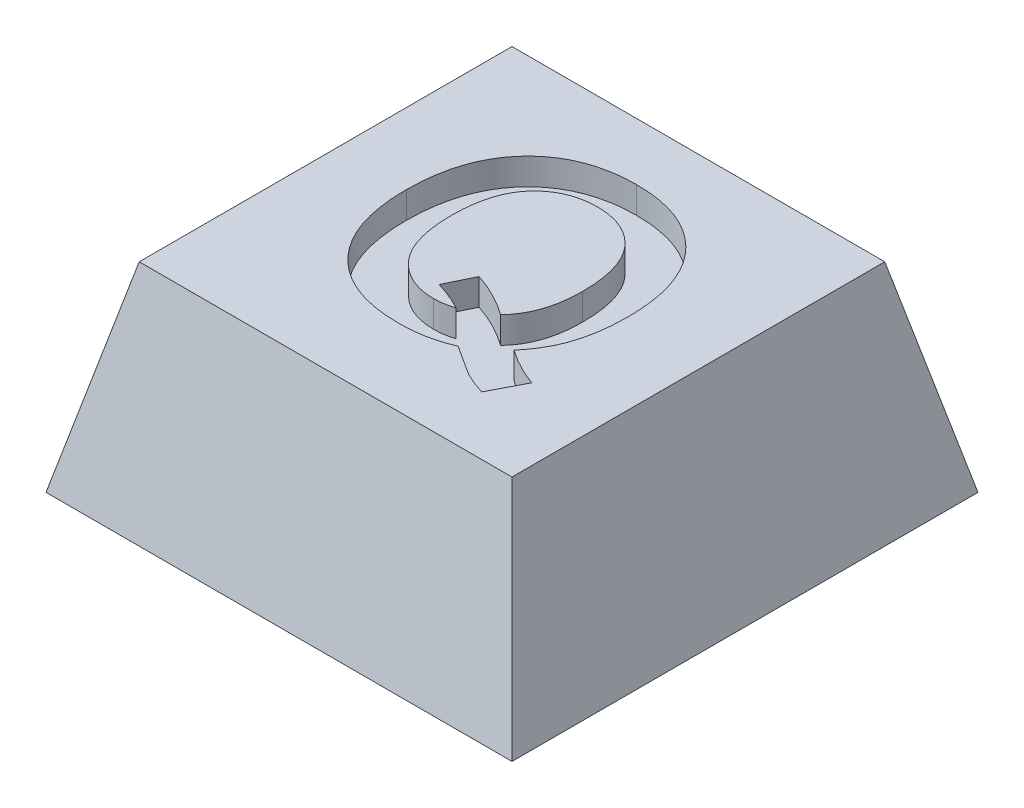
from build123d import *

# Parameters (mm, degrees)
SKETCH1_W           = 7
SKETCH1_H           = 7
BOSS_EXTRUDE1_DEPTH = 3
CUT_EXTRUDE1_DEPTH  = 7
CUT_EXTRUDE2_DEPTH  = 11
SKETCH4_R           = 1.8
CUT_EXTRUDE3_DEPTH  = 0.8
CUT_EXTRUDE4_DEPTH  = 0.4


with BuildPart() as part:
    # Sketch1 → Boss-Extrude1 (new body)
    with BuildSketch(Plane(origin=(0, 0, 0), x_dir=(1, 0, 0), z_dir=(0, 1, 0))):
        with Locations((3.5, 3.5)):
            Rectangle(SKETCH1_W, SKETCH1_H)
    extrude(amount=BOSS_EXTRUDE1_DEPTH)

    # Sketch2 → Cut-Extrude1 (cut)
    with BuildSketch(Plane.XY):
        Polygon((0, 0), (0.7, 3), (0, 3), align=None)
        Polygon((7, 0), (6.3, 3), (7, 3), align=None)
    extrude(amount=-CUT_EXTRUDE1_DEPTH, mode=Mode.SUBTRACT)

    # Sketch3 → Cut-Extrude2 (cut)
    with BuildSketch(Plane(origin=(0, 0, 0), x_dir=(0, 0, -1), z_dir=(1, 0, 0))):
        Polygon((0, 0), (0.7, 3), (0, 3), align=None)
        Polygon((7, 3), (6.3, 3), (7, 0), align=None)
    extrude(amount=CUT_EXTRUDE2_DEPTH, mode=Mode.SUBTRACT)

    # Sketch4 → Cut-Extrude3 (cut)
    with BuildSketch(Plane.XZ):
        with Locations(Location((3.5, -3.5, 0), (0, 0, 270))):
            Circle(SKETCH4_R)
    extrude(amount=-CUT_EXTRUDE3_DEPTH, mode=Mode.SUBTRACT)

    # Sketch6 → Cut-Extrude4 (cut)
    with BuildSketch(Plane(origin=(0, 3, 0), x_dir=(1, 0, 0), z_dir=(0, 1, 0))):
        with BuildLine():
            add(Edge.make_bspline(
                [(4.664072496, 2.366076672), (4.707347841, 2.33641431), (4.79406668, 2.276974329), (4.932000881, 2.200081193), (5.074319859, 2.130177652), (5.173227993, 2.092578566), (5.222866567, 2.073708884)],
                knots=[0, 0, 0, 0, 0.994855506, 1.99357661, 2.993045438, 4, 4, 4, 4], degree=3))
            Line((5.222866567, 2.073708884), (4.965554868, 1.58011914))
            add(Edge.make_bspline(
                [(4.965554868, 1.58011914), (4.912950568, 1.596402863), (4.806905677, 1.629229182), (4.706805134, 1.677225698), (4.656360157, 1.701413211)],
                knots=[0, 0, 0, 0, 0.992113803, 2, 2, 2, 2], degree=3))
            add(Edge.make_bspline(
                [(4.656360157, 1.701413211), (4.651410026, 1.703910751), (4.637075112, 1.711143291), (4.611037723, 1.728948088), (4.571310996, 1.752945912), (4.519597577, 1.786185947), (4.455377063, 1.827387082), (4.378441674, 1.876504864), (4.289852424, 1.934928076), (4.2261424, 1.976076602), (4.192217528, 1.99798773)],
                knots=[0, 0, 0, 0, 0.241377655, 0.698997227, 1.371388316, 2.263975901, 3.376788369, 4.695767198, 6.240533187, 8, 8, 8, 8], degree=3))
            add(Edge.make_bspline(
                [(4.192217528, 1.99798773), (4.164082126, 1.985938608), (4.107539341, 1.961723888), (4.019810769, 1.931906785), (3.929851311, 1.906788839), (3.83798057, 1.88548719), (3.743809701, 1.869659434), (3.647471832, 1.857521371), (3.548696902, 1.85040295), (3.481992412, 1.849703111), (3.448327304, 1.849349909)],
                knots=[0, 0, 0, 0, 0.961025642, 1.931341354, 2.907359807, 3.893838693, 4.891829695, 5.905170566, 6.942759923, 8, 8, 8, 8], degree=3))
            add(Edge.make_bspline(
                [(3.448327304, 1.849349909), (3.384469015, 1.850904143), (3.259644276, 1.853942228), (3.077633843, 1.87547395), (2.906612989, 1.912794393), (2.745831056, 1.96377118), (2.596254532, 2.030691184), (2.456571284, 2.111582166), (2.328715231, 2.208542848), (2.210924756, 2.318601555), (2.106714068, 2.44299724), (2.01548492, 2.579558487), (1.938201438, 2.727832608), (1.87588476, 2.888600431), (1.826634495, 3.060561995), (1.793056062, 3.244931239), (1.771444669, 3.440614719), (1.768994453, 3.575218022), (1.767738362, 3.644221704)],
                knots=[0, 0, 0, 0, 1.098101164, 2.146474535, 3.146072545, 4.104420533, 5.041773038, 5.958565538, 6.874115049, 7.795336865, 8.725215067, 9.658214839, 10.614563411, 11.594512188, 12.618591104, 13.685899083, 14.813688224, 16, 16, 16, 16], degree=3))
            add(Edge.make_bspline(
                [(1.767738362, 3.644221704), (1.768997302, 3.713222571), (1.771444596, 3.847355546), (1.7929084, 4.042662021), (1.827606571, 4.226372552), (1.876354652, 4.398607362), (1.939604685, 4.558913945), (2.017190294, 4.707202518), (2.10856287, 4.844051901), (2.214008903, 4.968173308), (2.331174894, 5.079358291), (2.459402401, 5.175598306), (2.597200561, 5.257768614), (2.745117273, 5.324625417), (2.903560867, 5.375574114), (3.071324913, 5.412775744), (3.249338156, 5.434570742), (3.371143561, 5.437560428), (3.433603746, 5.439093499)],
                knots=[0, 0, 0, 0, 1.193283781, 2.319662245, 3.393996131, 4.424093603, 5.411284417, 6.369670503, 7.313761776, 8.251713527, 9.181123148, 10.102053383, 11.01932051, 11.951118596, 12.903560284, 13.893239571, 14.919681386, 16, 16, 16, 16], degree=3))
            add(Edge.make_bspline(
                [(3.433603746, 5.439093499), (3.495615312, 5.437966268), (3.616563704, 5.435767699), (3.79292347, 5.412253487), (3.95956776, 5.376576627), (4.116694799, 5.325148401), (4.263499528, 5.258359333), (4.400745959, 5.177269062), (4.527633661, 5.081192592), (4.644198547, 4.971068574), (4.748454019, 4.847375423), (4.840809815, 4.712147514), (4.916635875, 4.563717786), (4.980514643, 4.404604546), (5.028132934, 4.233255975), (5.063284912, 4.050654395), (5.084451249, 3.856224461), (5.08696323, 3.722566855), (5.088251182, 3.654037409)],
                knots=[0, 0, 0, 0, 1.078752742, 2.104017338, 3.091035458, 4.041673215, 4.975566109, 5.892967701, 6.810684895, 7.740128604, 8.678185021, 9.621404646, 10.583875016, 11.573429805, 12.6009998, 13.674031063, 14.80742018, 16, 16, 16, 16], degree=3))
            add(Edge.make_bspline(
                [(5.088251182, 3.654037409), (5.086861856, 3.58175257), (5.084161048, 3.441232998), (5.060656035, 3.237166867), (5.02255362, 3.046054473), (4.983299325, 2.925957386), (4.964152625, 2.867378755)],
                knots=[0, 0, 0, 0, 1.083667057, 2.106616435, 3.076482036, 4, 4, 4, 4], degree=3))
            add(Edge.make_bspline(
                [(4.964152625, 2.867378755), (4.946989265, 2.824230782), (4.912073515, 2.73645404), (4.84305787, 2.609753708), (4.760943187, 2.484753896), (4.696820471, 2.406196533), (4.664072496, 2.366076672)],
                knots=[0, 0, 0, 0, 0.948216854, 1.928975575, 2.942311585, 4, 4, 4, 4], degree=3))
        make_face()
        with BuildLine():
            add(Edge.make_bspline(
                [(4.102473939, 2.726453275), (4.127780012, 2.754119398), (4.178452724, 2.809517857), (4.241114406, 2.90440552), (4.295822593, 3.006161549), (4.338835309, 3.117324632), (4.373428663, 3.236201997), (4.397571905, 3.363677482), (4.412566656, 3.499430632), (4.414289266, 3.592765315), (4.415174259, 3.640716095)],
                knots=[0, 0, 0, 0, 0.906820982, 1.815812261, 2.745108282, 3.70056618, 4.696560745, 5.740060838, 6.83895416, 8, 8, 8, 8], degree=3))
            add(Edge.make_bspline(
                [(4.415174259, 3.640716095), (4.414398079, 3.690052691), (4.412894495, 3.785625555), (4.400440515, 3.924411083), (4.378524584, 4.053416848), (4.349921684, 4.173180965), (4.310950729, 4.282734101), (4.263951968, 4.382902013), (4.208851462, 4.473931164), (4.144295177, 4.554319676), (4.073289316, 4.624992614), (3.997385018, 4.687424679), (3.915473431, 4.739684176), (3.827971743, 4.781723701), (3.735612195, 4.814802537), (3.638175965, 4.838817015), (3.53544327, 4.852870135), (3.465197405, 4.854784514), (3.429397016, 4.855760166)],
                knots=[0, 0, 0, 0, 1.335693338, 2.587451293, 3.768164612, 4.876224393, 5.916940853, 6.910477009, 7.867661778, 8.790666633, 9.694493319, 10.576027549, 11.446684429, 12.318352473, 13.199023277, 14.098364444, 15.030842682, 16, 16, 16, 16], degree=3))
            add(Edge.make_bspline(
                [(3.429397016, 4.855760166), (3.393356942, 4.854816175), (3.322865485, 4.852969805), (3.220031689, 4.838575915), (3.122373109, 4.815718183), (3.030128831, 4.782378038), (2.942464926, 4.740258761), (2.860247279, 4.688096064), (2.783487349, 4.626644322), (2.712123891, 4.556417609), (2.648385937, 4.476003653), (2.59172793, 4.38655956), (2.54488942, 4.287055852), (2.507276462, 4.178050834), (2.47721761, 4.060104683), (2.455571683, 3.932584455), (2.443101443, 3.795681707), (2.4415926, 3.701272351), (2.440815285, 3.652635166)],
                knots=[0, 0, 0, 0, 0.980107447, 1.917010591, 2.819119613, 3.703969481, 4.579773866, 5.459928929, 6.346604172, 7.250235365, 8.177620171, 9.131899985, 10.124404622, 11.161948974, 12.264485933, 13.431998172, 14.677033863, 16, 16, 16, 16], degree=3))
            add(Edge.make_bspline(
                [(2.440815285, 3.652635166), (2.441573469, 3.603294377), (2.44304577, 3.507480607), (2.45578752, 3.368559232), (2.476444238, 3.239125728), (2.505849447, 3.119233667), (2.543445207, 3.008746086), (2.589753063, 2.907816949), (2.64452751, 2.816572472), (2.707944858, 2.735840547), (2.77770996, 2.664816022), (2.852256943, 2.602898033), (2.930980725, 2.549856537), (3.014248538, 2.506760434), (3.102082714, 2.473663846), (3.194176957, 2.449777413), (3.291067215, 2.435539876), (3.35713374, 2.433648211), (3.390835317, 2.432683243)],
                knots=[0, 0, 0, 0, 1.356840463, 2.634818045, 3.833173645, 4.958776583, 6.025986406, 7.038359119, 8.007356852, 8.946032033, 9.855123386, 10.740685277, 11.607120956, 12.460971081, 13.313368256, 14.183325659, 15.073285775, 16, 16, 16, 16], degree=3))
            add(Edge.make_bspline(
                [(3.390835317, 2.432683243), (3.416109581, 2.433126684), (3.465894623, 2.43400017), (3.53944648, 2.443818905), (3.611093649, 2.458013111), (3.65736983, 2.472466064), (3.680398618, 2.479658403)],
                knots=[0, 0, 0, 0, 1.028828871, 2.026578908, 3.017950568, 4, 4, 4, 4], degree=3))
            add(Edge.make_bspline(
                [(3.680398618, 2.479658403), (3.645092364, 2.498106364), (3.575176857, 2.534638095), (3.467084084, 2.581186178), (3.358775331, 2.62312493), (3.28511213, 2.645783016), (3.248507593, 2.657042217)],
                knots=[0, 0, 0, 0, 1.021704821, 2.023239566, 3.017713044, 4, 4, 4, 4], degree=3))
            Line((3.248507593, 2.657042217), (3.444120573, 3.060888371))
            add(Edge.make_bspline(
                [(3.444120573, 3.060888371), (3.501325249, 3.041120096), (3.616286729, 3.001392746), (3.7823537, 2.92250788), (3.946106427, 2.832725945), (4.049959461, 2.762143896), (4.102473939, 2.726453275)],
                knots=[0, 0, 0, 0, 0.979271047, 1.967993817, 2.972492781, 4, 4, 4, 4], degree=3))
        make_face(mode=Mode.SUBTRACT)
    extrude(amount=-CUT_EXTRUDE4_DEPTH, mode=Mode.SUBTRACT)


solid = part.part
